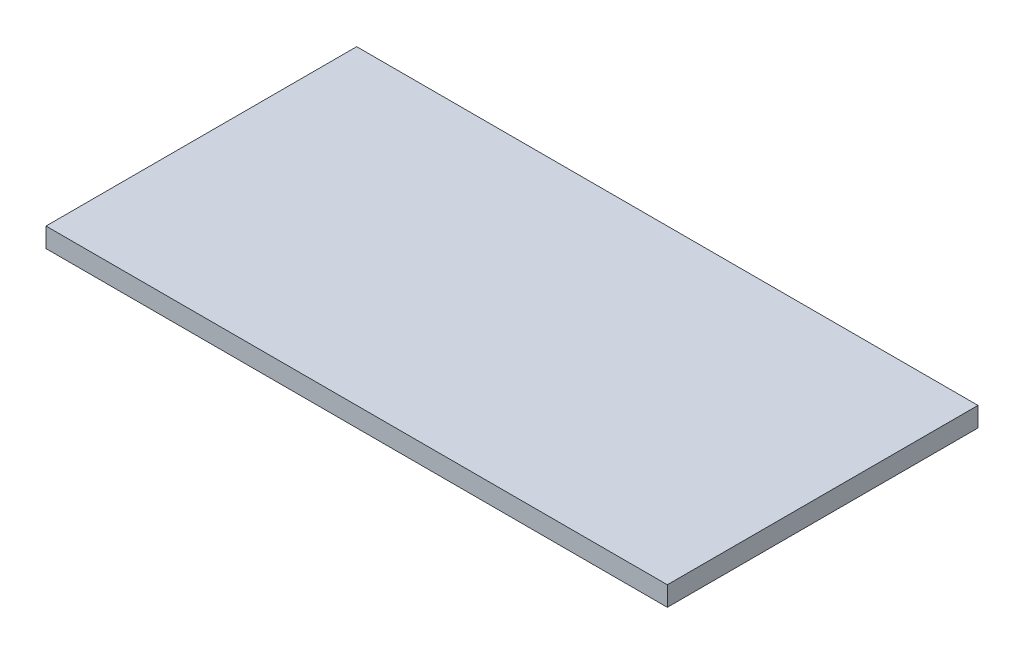
from build123d import *

# Parameters (mm, degrees)
SKETCH1_W           = 50.8
SKETCH1_H           = 25.4
BOSS_EXTRUDE1_DEPTH = 0.8


with BuildPart() as part:
    # Sketch1 → Boss-Extrude1 (new, symmetric)
    with BuildSketch(Plane(origin=(0, 0, 0), x_dir=(1, 0, 0), z_dir=(0, 1, 0))):
        Rectangle(SKETCH1_W, SKETCH1_H)
    extrude(amount=BOSS_EXTRUDE1_DEPTH, both=True)


solid = part.part
